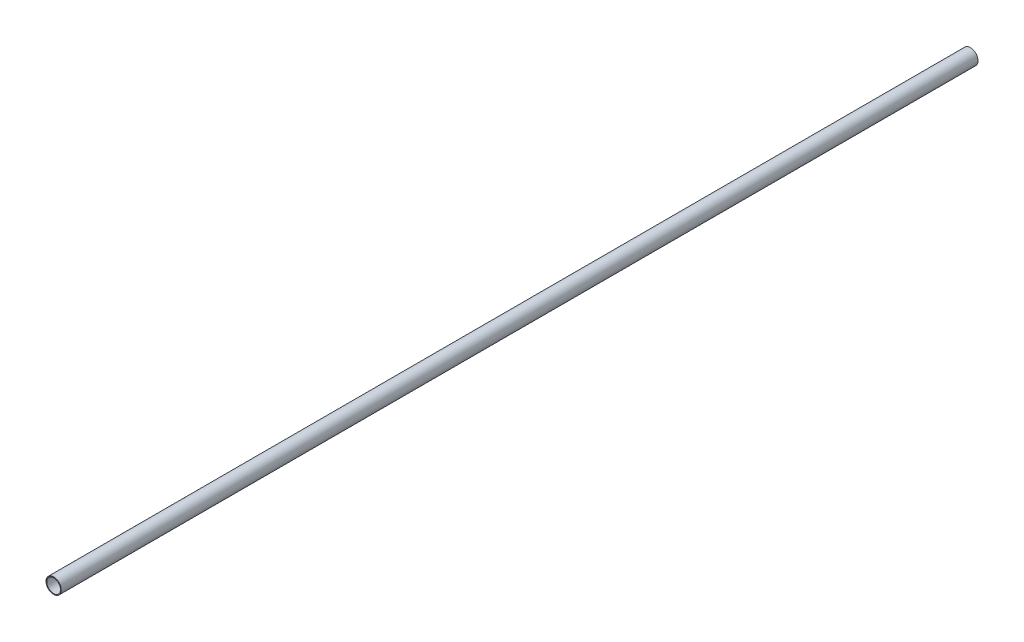
from build123d import *

# Parameters (mm, degrees)
BOSS_EXTRUDE1_DEPTH      = 368.3
BOSS_EXTRUDE1_DEPTH_BACK = 12.7
SKETCH1_R                = 3.175
SKETCH1_R_2              = 2.8575


with BuildPart() as part:
    # Sketch1 → Boss-Extrude1 (new, two sides: drawn at the far end of the back side and taken through both)
    with BuildSketch(Plane.XY.offset(-BOSS_EXTRUDE1_DEPTH_BACK)):
        Circle(SKETCH1_R)
        Circle(SKETCH1_R_2, mode=Mode.SUBTRACT)
    extrude(amount=BOSS_EXTRUDE1_DEPTH + BOSS_EXTRUDE1_DEPTH_BACK)


solid = part.part
